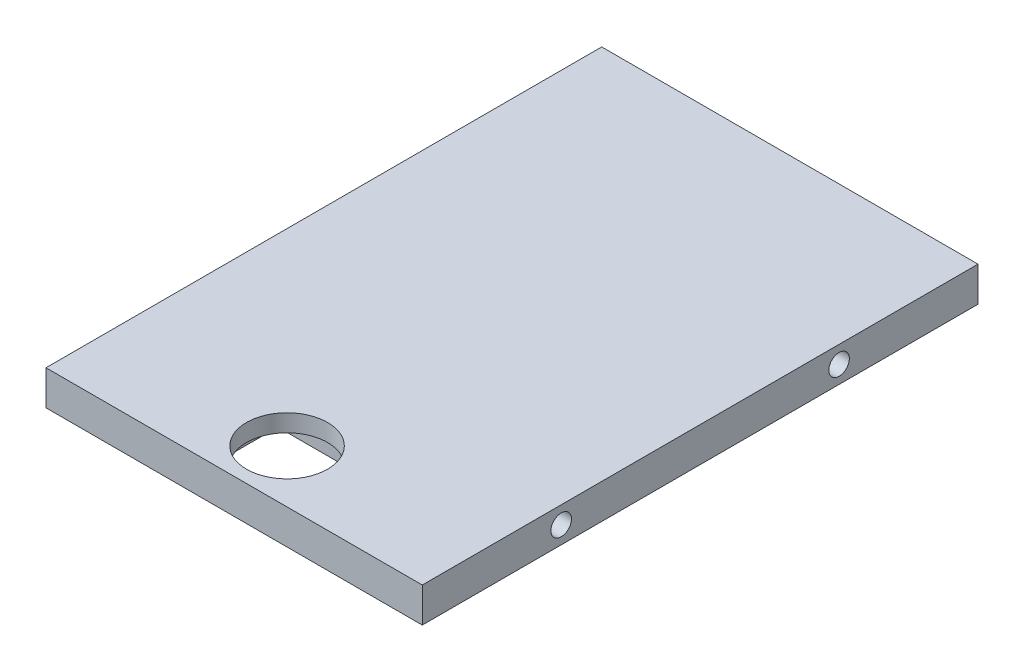
from build123d import *

# Parameters (mm, degrees)
SKETCH1_W                 = 32.5
SKETCH1_H                 = 48
BOSS_EXTRUDE1_DEPTH       = 3
F_2_56_TAPPED_HOLE1_D     = 1.778
F_2_56_TAPPED_HOLE1_DEPTH = 7.46583491
F_2_56_TAPPED_HOLE1_TIP   = 0.53416509
F_2_56_TAPPED_HOLE2_D     = 1.778
F_2_56_TAPPED_HOLE2_DEPTH = 7.46583491
F_2_56_TAPPED_HOLE2_TIP   = 0.53416509
CUT_EXTRUDE2_DEPTH        = 1.5
SKETCH10_R                = 3.5
CUT_EXTRUDE3_DEPTH        = 3


with BuildPart() as part:
    # Sketch1 → Boss-Extrude1 (new body)
    with BuildSketch(Plane(origin=(0, 0, 0), x_dir=(1, 0, 0), z_dir=(0, 1, 0))):
        with Locations((16.25, 24)):
            Rectangle(SKETCH1_W, SKETCH1_H)
    extrude(amount=BOSS_EXTRUDE1_DEPTH)

    # #2-56 Tapped Hole1
    with Locations(Plane.ZY):
        with Locations((-36, 1.5), (-12, 1.5)):
            Hole(F_2_56_TAPPED_HOLE1_D / 2, depth=F_2_56_TAPPED_HOLE1_DEPTH)
            with Locations((0, 0, -(F_2_56_TAPPED_HOLE1_DEPTH + F_2_56_TAPPED_HOLE1_TIP / 2))):  # 118° drill point
                Cone(0, F_2_56_TAPPED_HOLE1_D / 2, F_2_56_TAPPED_HOLE1_TIP, mode=Mode.SUBTRACT)

    # #2-56 Tapped Hole2
    with Locations(Plane(origin=(32.5, 0, 0), x_dir=(0, 0, -1), z_dir=(1, 0, 0))):
        with Locations((12, 1.5), (36, 1.5)):
            Hole(F_2_56_TAPPED_HOLE2_D / 2, depth=F_2_56_TAPPED_HOLE2_DEPTH)
            with Locations((0, 0, -(F_2_56_TAPPED_HOLE2_DEPTH + F_2_56_TAPPED_HOLE2_TIP / 2))):  # 118° drill point
                Cone(0, F_2_56_TAPPED_HOLE2_D / 2, F_2_56_TAPPED_HOLE2_TIP, mode=Mode.SUBTRACT)

    # Sketch11 → Cut-Extrude2 (cut)
    with BuildSketch(Plane(origin=(0, 0, 0), x_dir=(-1, 0, 0), z_dir=(0, -1, 0))):
        Polygon((-21.05, 4.57), (-21.05, 8.57), (-11.45, 8.57), (-11.45, 0.57), (-21.05, 0.57), align=None)
    extrude(amount=-CUT_EXTRUDE2_DEPTH, mode=Mode.SUBTRACT)

    # Sketch10 → Cut-Extrude3 (cut)
    with BuildSketch(Plane(origin=(0, 3, 0), x_dir=(1, 0, 0), z_dir=(0, 1, 0))):
        with Locations(Location((16.25, 4.57, 0), (0, 0, 270))):
            Circle(SKETCH10_R)
    extrude(amount=-CUT_EXTRUDE3_DEPTH, mode=Mode.SUBTRACT)


solid = part.part
